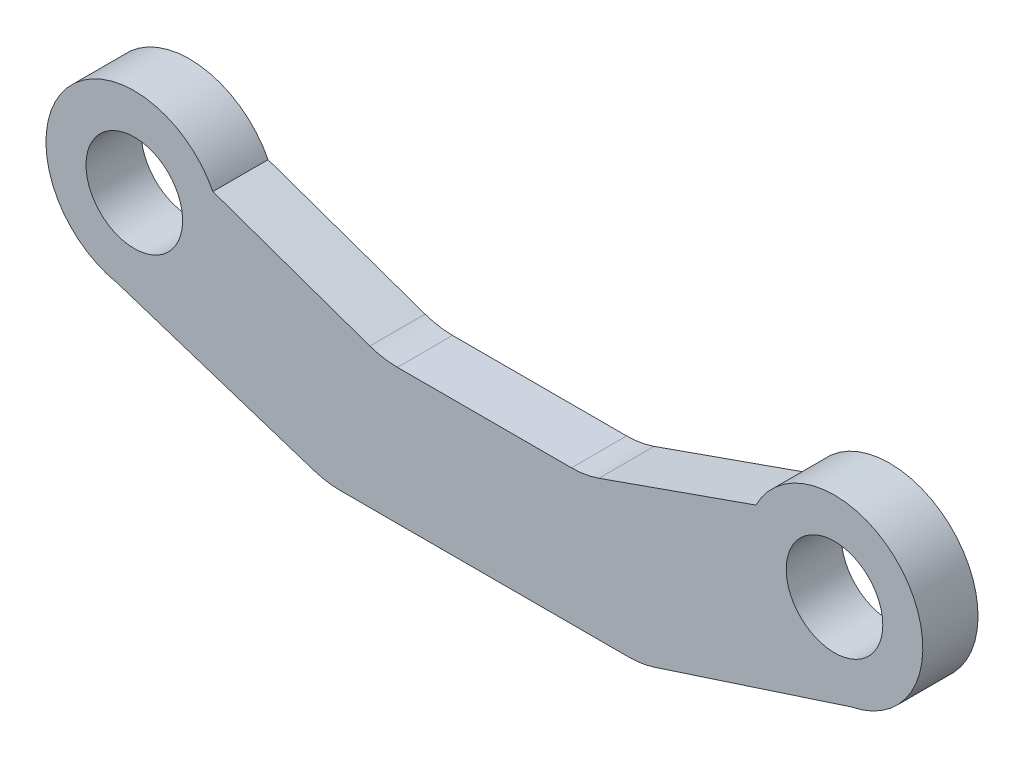
from build123d import *

# Parameters (mm, degrees)
CROQUIS1_R              = 1.75
SALIENTE_EXTRUIR1_DEPTH = 2


with BuildPart() as part:
    # Croquis1 → Saliente-Extruir1 (new body)
    with BuildSketch(Plane.XY):
        with BuildLine():
            Line((13.871153062, 23.274726508), (24.330135763, 23.274726508))
            ThreePointArc((24.330135763, 23.274726508), (24.799781514, 23.311715731), (25.257846044, 23.421771263))
            Line((25.257846044, 23.421771263), (32.405644412, 25.746057998))
            ThreePointArc((32.405644412, 25.746057998), (34.336780797, 30.811489821), (28.935644412, 30.347148308))
            Line((28.935644412, 30.347148308), (23.249258293, 28.345004197))
            ThreePointArc((23.249258293, 28.345004197), (22.758316719, 28.21760232), (22.252929212, 28.174726508))
            Line((22.252929212, 28.174726508), (15.948359613, 28.174726508))
            ThreePointArc((15.948359613, 28.174726508), (15.442972106, 28.21760232), (14.952030531, 28.345004197))
            Line((14.952030531, 28.345004197), (9.265644412, 30.347148308))
            ThreePointArc((9.265644412, 30.347148308), (3.864508027, 30.811489821), (5.795644412, 25.746057998))
            Line((5.795644412, 25.746057998), (12.94344278, 23.421771263))
            ThreePointArc((12.94344278, 23.421771263), (13.401507311, 23.311715731), (13.871153062, 23.274726508))
        make_face()
        with Locations((31.781902577, 28.88467969)):
            Circle(CROQUIS1_R, mode=Mode.SUBTRACT)
        with Locations(Location((6.419386247, 28.88467969, 0), (0, 0, 180))):
            Circle(CROQUIS1_R, mode=Mode.SUBTRACT)
    extrude(amount=SALIENTE_EXTRUIR1_DEPTH)


solid = part.part
